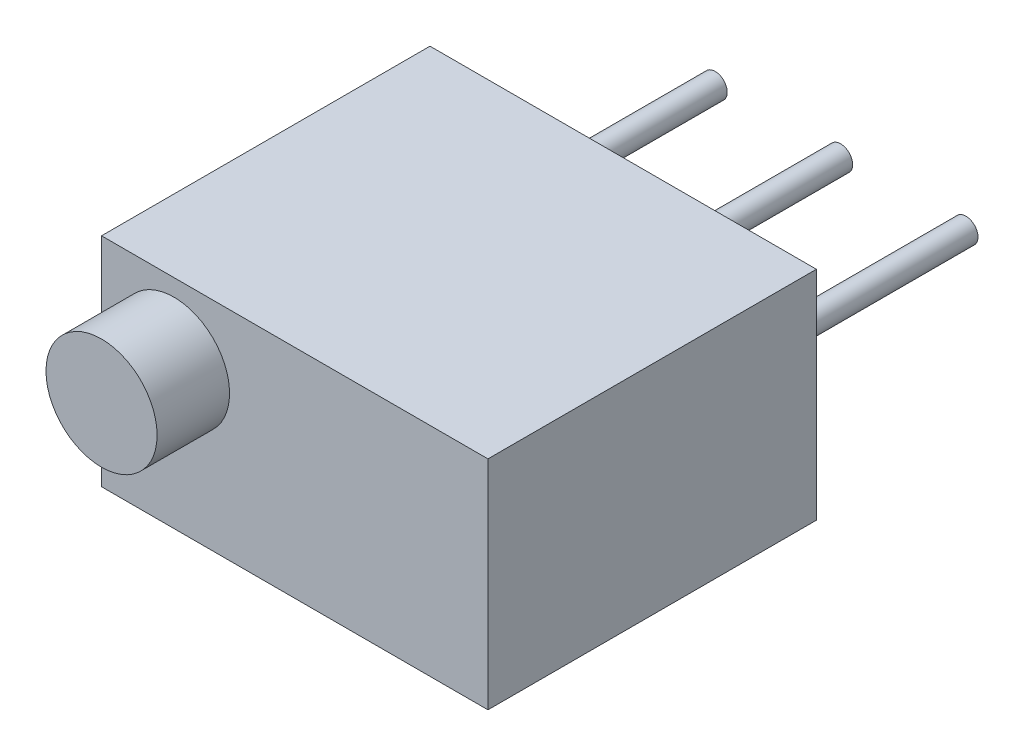
from build123d import *

# Parameters (mm, degrees)
SKETCH_1_W      = 8
SKETCH_1_H      = 6.8
EXTRUDE_1_DEPTH = 4.5
SKETCH_3_R      = 0.25
EXTRUDE_3_DEPTH = 4.5
SKETCH_4_R      = 1.15
EXTRUDE_4_DEPTH = 1.5


with BuildPart() as part:
    # 草图1 → 拉伸1 (new body)
    with BuildSketch(Plane(origin=(0, 0, 0), x_dir=(1, 0, 0), z_dir=(0, 1, 0))):
        Rectangle(SKETCH_1_W, SKETCH_1_H)
    extrude(amount=EXTRUDE_1_DEPTH)

    # 草图3 → 拉伸3 (add)
    with BuildSketch(Plane(origin=(0, 0, -3.4), x_dir=(-1, 0, 0), z_dir=(0, 0, -1))):
        with Locations(Location((0, 2.25, 0), (0, 0, 180))):
            Circle(SKETCH_3_R)
        with Locations(Location((2.595978382, 2.25, 0), (0, 0, 180))):
            Circle(SKETCH_3_R)
        with Locations(Location((-2.595978382, 2.25, 0), (0, 0, 180))):
            Circle(SKETCH_3_R)
    extrude(amount=EXTRUDE_3_DEPTH)

    # 草图4 → 拉伸4 (add)
    with BuildSketch(Plane.XY.offset(3.4)):
        with Locations(Location((-2.5, 3, 0), (0, 0, 180))):
            Circle(SKETCH_4_R)
    extrude(amount=EXTRUDE_4_DEPTH)


solid = part.part
